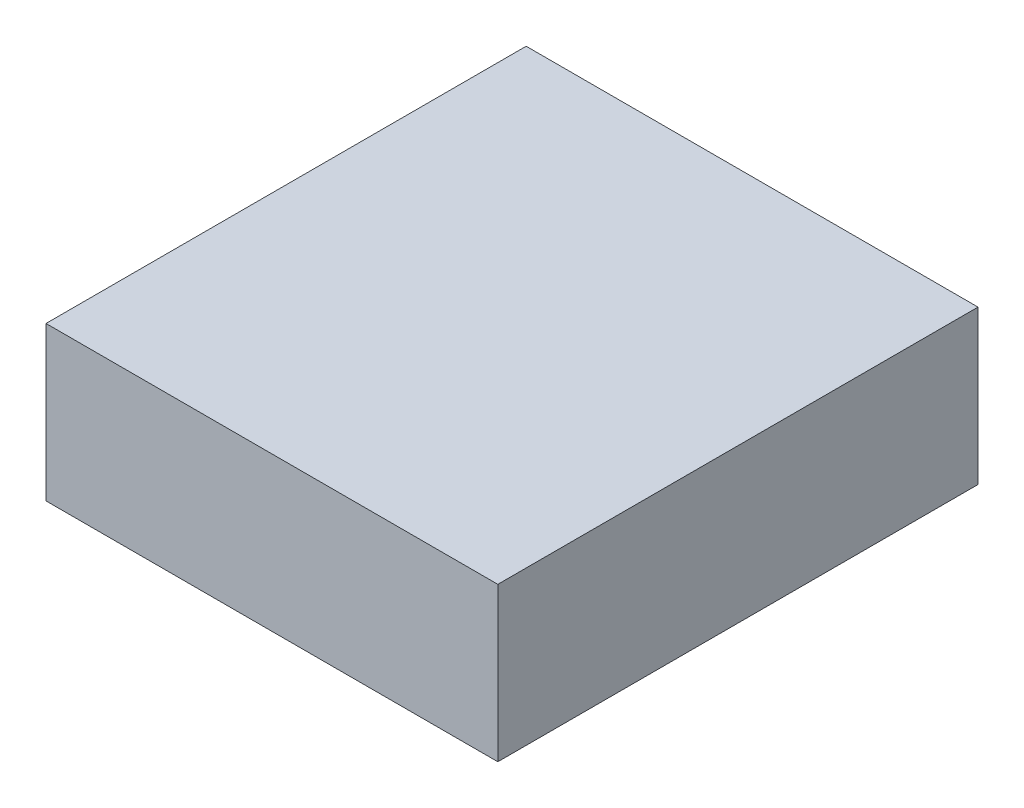
from build123d import *

# Parameters (mm, degrees)
SKETCH1_W           = 90.17
SKETCH1_H           = 95.83
BOSS_EXTRUDE1_DEPTH = 30.67


with BuildPart() as part:
    # Sketch1 → Boss-Extrude1 (new body)
    with BuildSketch(Plane(origin=(0, 0, 0), x_dir=(1, 0, 0), z_dir=(0, 1, 0))):
        Rectangle(SKETCH1_W, SKETCH1_H)
    extrude(amount=BOSS_EXTRUDE1_DEPTH)


solid = part.part
